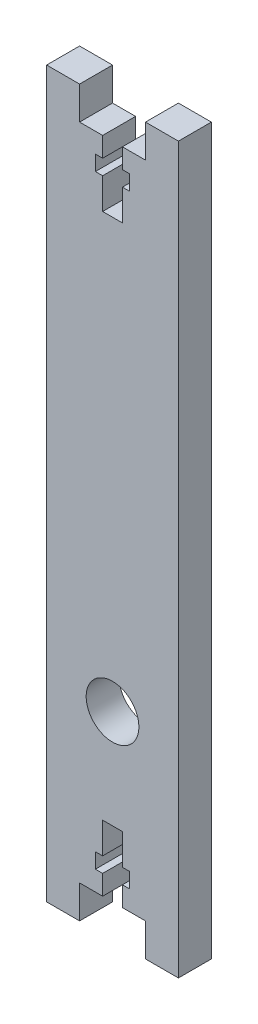
from build123d import *

# Parameters (mm, degrees)
SKETCH1_R           = 4
BOSS_EXTRUDE1_DEPTH = 5


with BuildPart() as part:
    # Sketch1 → Boss-Extrude1 (new body)
    with BuildSketch(Plane.XY):
        Polygon((-10, 80), (-10, -20), (-10, -25), (-5, -25), (-5, -20), (-1.5, -20), (-1.5, -17), (-2.6, -17), (-2.6, -14.7), (-1.5, -14.7), (-1.5, -10), (1.5, -10), (1.5, -14.7), (2.6, -14.7), (2.6, -17), (1.5, -17), (1.5, -20), (5, -20), (5, -25), (10, -25), (10, -20), (10, 80), (10, 85), (5, 85), (5, 80), (1.5, 80), (1.5, 77), (2.6, 77), (2.6, 74.7), (1.5, 74.7), (1.5, 70), (-1.5, 70), (-1.5, 74.7), (-2.6, 74.7), (-2.6, 77), (-1.5, 77), (-1.5, 80), (-5, 80), (-5, 85), (-10, 85), align=None)
        with Locations((0, 5)):
            Circle(SKETCH1_R, mode=Mode.SUBTRACT)
    extrude(amount=BOSS_EXTRUDE1_DEPTH)


solid = part.part
